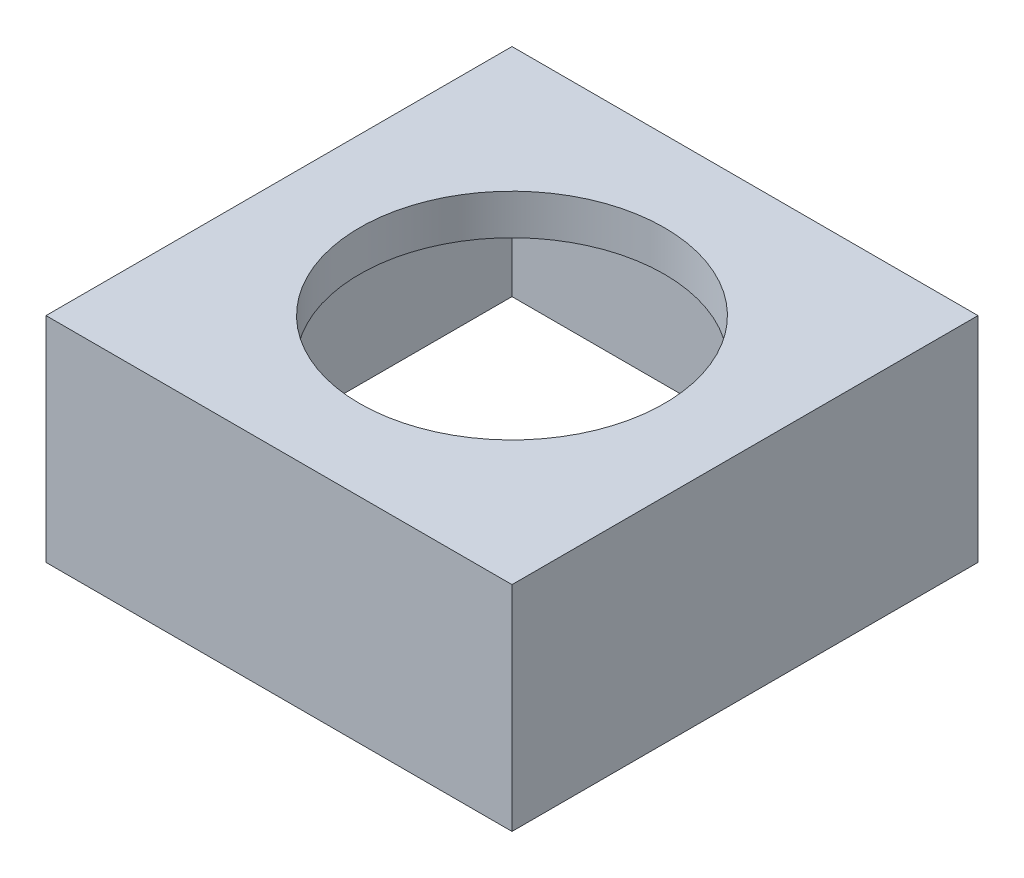
from build123d import *

# Parameters (mm, degrees)
SKETCH1_W           = 497
SKETCH1_H           = 497
SKETCH1_W_2         = 491
SKETCH1_H_2         = 491
BOSS_EXTRUDE1_DEPTH = 225
SKETCH2_W           = 497
SKETCH2_H           = 497
BOSS_EXTRUDE2_DEPTH = 3
CUT_EXTRUDE1_REACH  = 420.913
SKETCH3_R           = 162.5
SKETCH4_R           = 166
SKETCH4_R_2         = 162.5
BOSS_EXTRUDE3_DEPTH = 40


with BuildPart() as part:
    # Sketch1 → Boss-Extrude1 (new body)
    with BuildSketch(Plane(origin=(0, 0, 0), x_dir=(1, 0, 0), z_dir=(0, 1, 0))):
        Rectangle(SKETCH1_W, SKETCH1_H)
        Rectangle(SKETCH1_W_2, SKETCH1_H_2, mode=Mode.SUBTRACT)
    extrude(amount=BOSS_EXTRUDE1_DEPTH)

    # Sketch2 → Boss-Extrude2 (add)
    with BuildSketch(Plane(origin=(0, 225, 0), x_dir=(1, 0, 0), z_dir=(0, 1, 0))):
        Rectangle(SKETCH2_W, SKETCH2_H)
    extrude(amount=BOSS_EXTRUDE2_DEPTH)

    # Sketch3 → Cut-Extrude1 (cut, up to next)
    with BuildSketch(Plane(origin=(0, 228, 0), x_dir=(1, 0, 0), z_dir=(0, 1, 0)), mode=Mode.PRIVATE) as cut_extrude1_sk1:
        with Locations(Location((0, 0, 0), (0, 0, 270))):
            Circle(SKETCH3_R)
    cut_extrude1_tool1 = extrude(cut_extrude1_sk1.sketch, amount=-CUT_EXTRUDE1_REACH, mode=Mode.PRIVATE) & part.part
    add(cut_extrude1_tool1.solids().sort_by_distance((0, 228, 0))[0], mode=Mode.SUBTRACT)

    # Sketch4 → Boss-Extrude3 (add)
    with BuildSketch(Plane.XZ.offset(-225)):
        with Locations(Location((0, 0, 0), (0, 0, 90))):
            Circle(SKETCH4_R)
        with Locations(Location((0, 0, 0), (0, 0, 90))):
            Circle(SKETCH4_R_2, mode=Mode.SUBTRACT)
    extrude(amount=BOSS_EXTRUDE3_DEPTH)


solid = part.part
